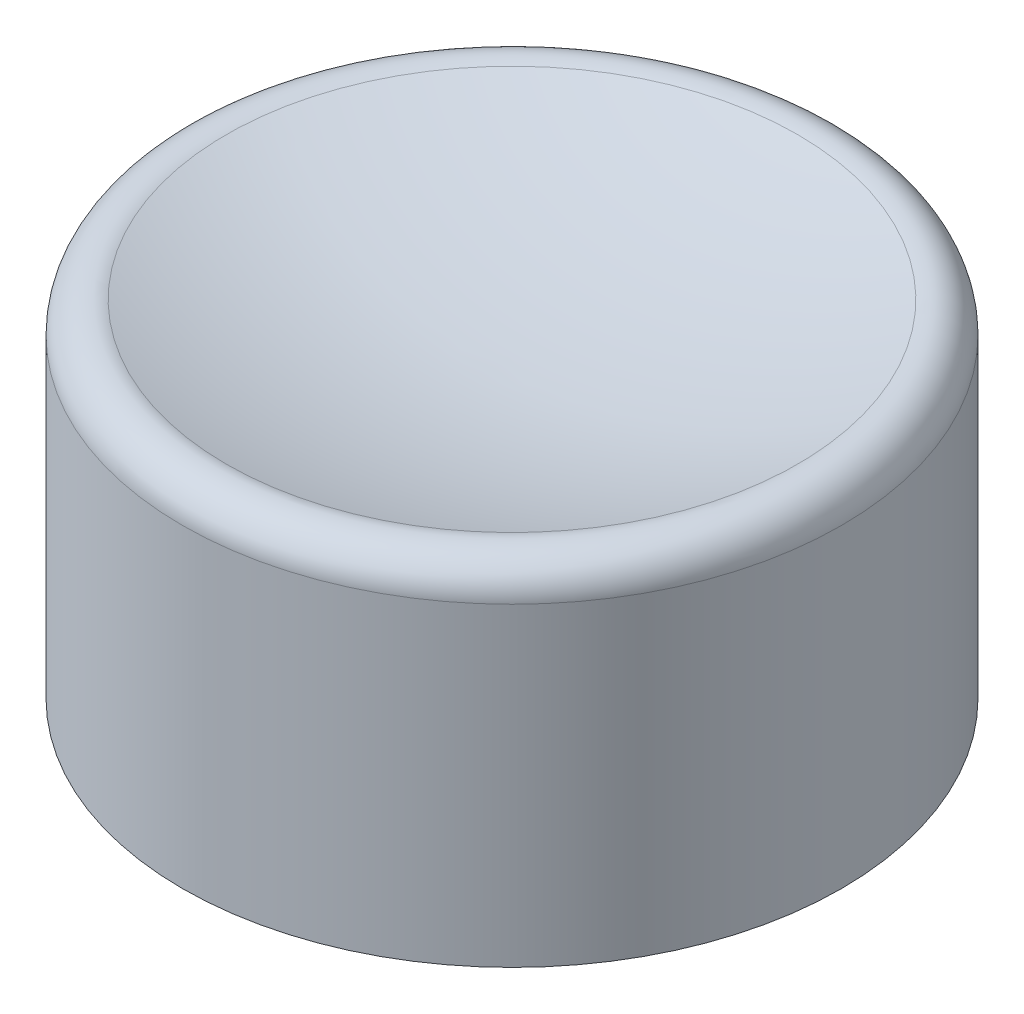
from build123d import *

# Parameters (mm, degrees)
SKETCH1_R           = 5
BOSS_EXTRUDE1_DEPTH = 5.5
SKETCH2_R           = 1.75
CUT_EXTRUDE1_DEPTH  = 4
DOME1_FACE_RADIUS   = 5
DOME1_HEIGHT        = 1
FILLET1_R           = 0.5


with BuildPart() as part:
    # Sketch1 → Boss-Extrude1 (new body)
    with BuildSketch(Plane(origin=(0, 0, 0), x_dir=(1, 0, 0), z_dir=(0, 1, 0))):
        with Locations(Location((0, 0, 0), (0, 0, 270))):
            Circle(SKETCH1_R)
    extrude(amount=BOSS_EXTRUDE1_DEPTH)

    # Sketch2 → Cut-Extrude1 (cut)
    with BuildSketch(Plane.XZ):
        with Locations(Location((0, 0, 0), (0, 0, 270))):
            Circle(SKETCH2_R)
    extrude(amount=-CUT_EXTRUDE1_DEPTH, mode=Mode.SUBTRACT)

    # Dome1: a dome of height H over a round flat face of radius A is a cap of a sphere of radius (A * A + H * H) / (2 * H)
    dome1_r = (DOME1_FACE_RADIUS * DOME1_FACE_RADIUS + DOME1_HEIGHT * DOME1_HEIGHT) / (2 * DOME1_HEIGHT)
    dome1_base = Plane((0, 5.5, 0), z_dir=(0, -1, 0))
    with Locations(dome1_base.offset(DOME1_HEIGHT - dome1_r)):
        dome1_ball = Sphere(dome1_r, mode=Mode.PRIVATE)
    add(split(dome1_ball, bisect_by=dome1_base, keep=Keep.TOP, mode=Mode.PRIVATE), mode=Mode.SUBTRACT)

    # Fillet1
    fillet1_edges = [part.edges().sort_by_distance(p)[0] for p in [
        (-5, 5.5, 0),
    ]]
    fillet(fillet1_edges, radius=FILLET1_R)


solid = part.part
